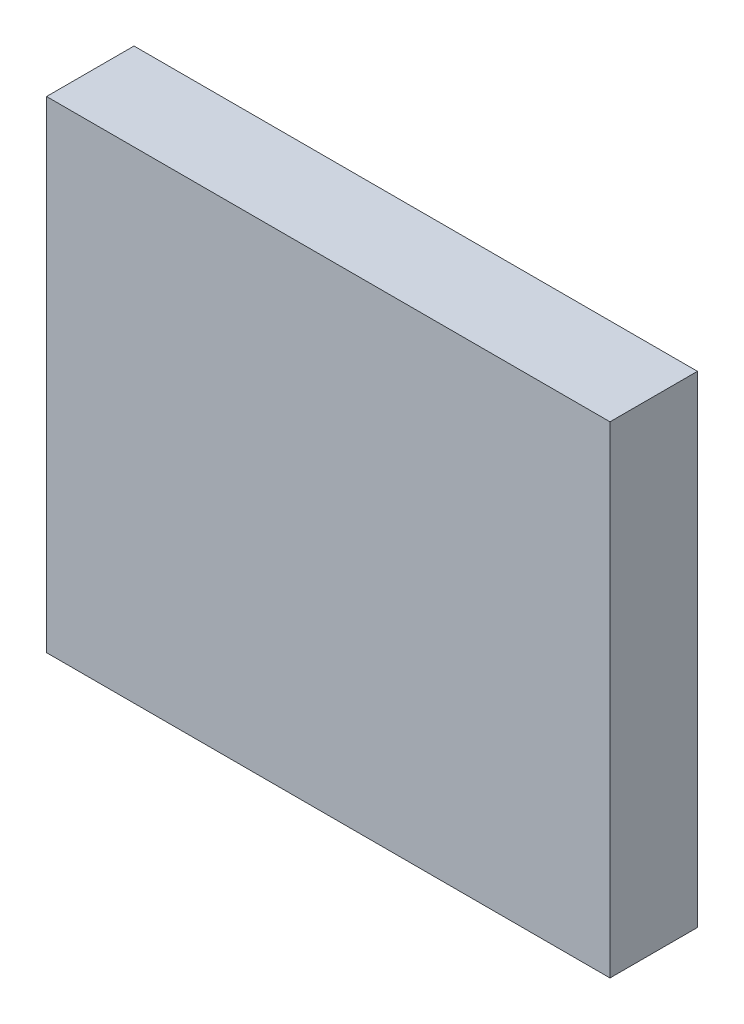
from build123d import *

# Parameters (mm, degrees)
SKETCH1_W      = 64.42099369
SKETCH1_H      = 55.074942791
EXTRUDE1_DEPTH = 10


with BuildPart() as part:
    # Sketch1 → Extrude1 (new body)
    with BuildSketch(Plane.XY):
        with Locations((-5.229854302, -2.169618959)):
            Rectangle(SKETCH1_W, SKETCH1_H)
    extrude(amount=EXTRUDE1_DEPTH)


solid = part.part
